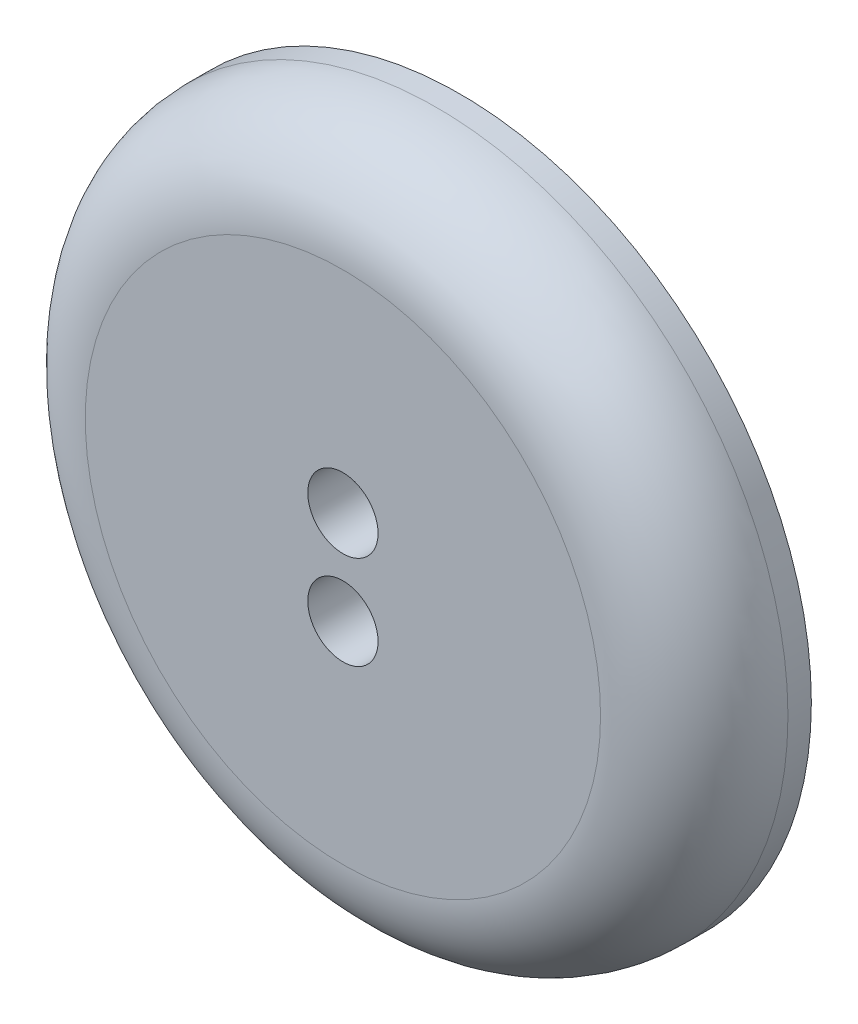
from build123d import *

# Parameters (mm, degrees)
SKETCH1_R           = 15
SKETCH1_R_2         = 1.5
BOSS_EXTRUDE1_DEPTH = 5
FILLET3_R           = 4


with BuildPart() as part:
    # Sketch1 → Boss-Extrude1 (new body)
    with BuildSketch(Plane.XY):
        Circle(SKETCH1_R)
        with Locations((0, 2)):
            Circle(SKETCH1_R_2, mode=Mode.SUBTRACT)
        with Locations((0, -2)):
            Circle(SKETCH1_R_2, mode=Mode.SUBTRACT)
    extrude(amount=BOSS_EXTRUDE1_DEPTH)

    # Fillet3
    fillet3_edges = [part.edges().sort_by_distance(p)[0] for p in [
        (-15, 0, 5),
    ]]
    fillet(fillet3_edges, radius=FILLET3_R)


solid = part.part
